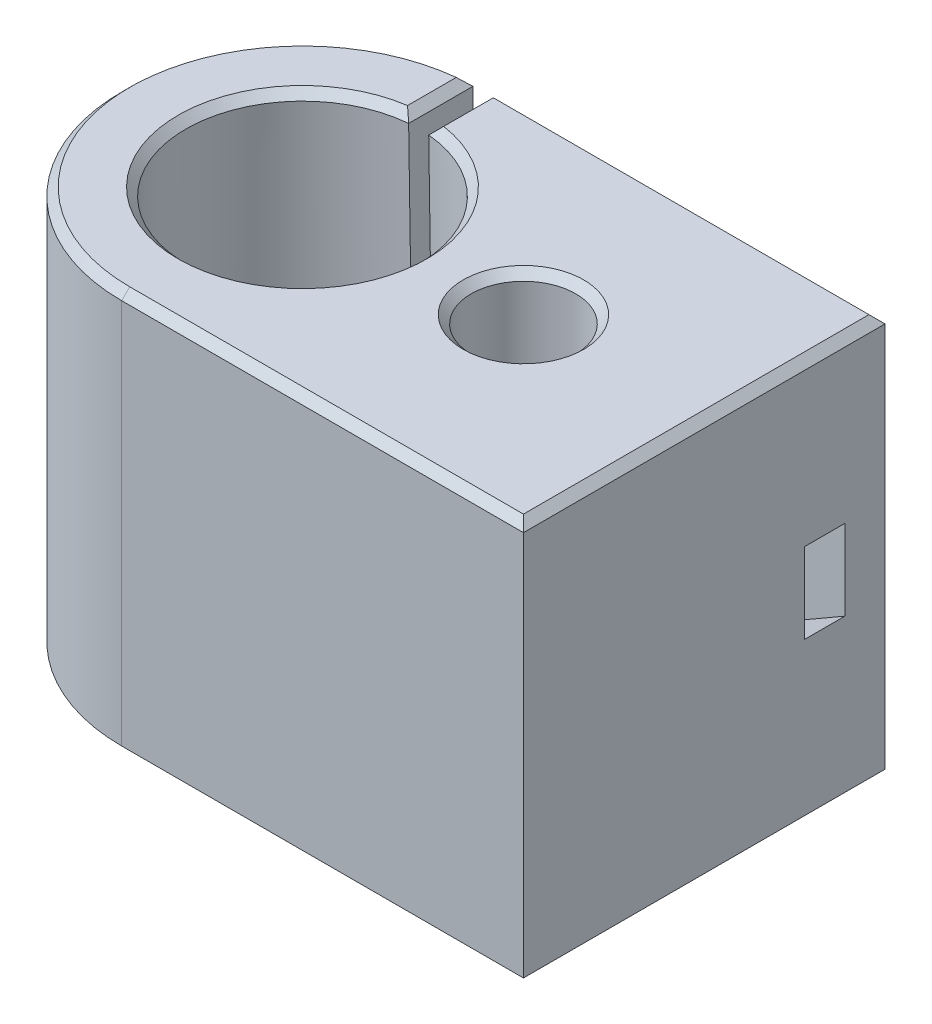
from build123d import *
from OCP.BRepFilletAPI import BRepFilletAPI_MakeChamfer

# Parameters (mm, degrees)
BOSS_EXTRUDE1_DEPTH = 20
SKETCH4_W           = 1
SKETCH4_H           = 9
CUT_EXTRUDE2_DEPTH  = 20
CUT_EXTRUDE4_START  = -2
CUT_EXTRUDE4_DEPTH  = 2
SKETCH5_R           = 2.6
CUT_EXTRUDE5_DEPTH  = 20
CHAMFER1_SIZE       = 0.4
CHAMFER1_SIZE2      = 0.406137053
CHAMFER1_SIZE2_2    = 0.394133002


with BuildPart() as part:
    # Sketch1 → Boss-Extrude1 (new body)
    with BuildSketch(Plane(origin=(0, 0, 0), x_dir=(1, 0, 0), z_dir=(0, 1, 0))):
        with BuildLine():
            Line((0, 9), (20, 9))
            Line((20, 9), (20, -9))
            Line((20, -9), (0, -9))
            ThreePointArc((0, -9), (-9, 0), (0, 9))
        make_face()
    extrude(amount=BOSS_EXTRUDE1_DEPTH)

    # Sketch7 → Cut-Revolve1 (revolve, cut)
    with BuildSketch(Plane.XY, mode=Mode.PRIVATE) as cut_revolve1_sk:
        Polygon((0, 0), (-6.1, 0), (-5.8, 20), (0, 20), align=None)
    revolve(cut_revolve1_sk.sketch.rotate(Axis((0, 20, 0), (0, 1, 0)), 180), axis=Axis((0, 20, 0), (0, 1, 0)), mode=Mode.SUBTRACT)

    # Sketch4 → Cut-Extrude2 (cut)
    with BuildSketch(Plane(origin=(0, 20, 0), x_dir=(1, 0, 0), z_dir=(0, 1, 0))):
        with Locations((0, 4.5)):
            Rectangle(SKETCH4_W, SKETCH4_H)
    extrude(amount=-CUT_EXTRUDE2_DEPTH, mode=Mode.SUBTRACT)

    # Sketch6 → Cut-Extrude4 (cut)
    with BuildSketch(Plane(origin=(0, 0, -9), x_dir=(-1, 0, 0), z_dir=(0, 0, -1)).offset(CUT_EXTRUDE4_START)):
        Polygon((-20, 12), (-14, 15.464101615), (-14, 4.535898385), (-20, 8), align=None)
    extrude(amount=-CUT_EXTRUDE4_DEPTH, mode=Mode.SUBTRACT)

    # Sketch5 → Cut-Extrude5 (cut)
    with BuildSketch(Plane(origin=(0, 20, 0), x_dir=(1, 0, 0), z_dir=(0, 1, 0))):
        with Locations(Location((11, 0, 0), (0, 0, 270))):
            Circle(SKETCH5_R)
    extrude(amount=-CUT_EXTRUDE5_DEPTH, mode=Mode.SUBTRACT)

    # Chamfer1: one chamfer whose edges measure the first distance from different faces: ONE call of the kernel's chamfer builder (chamfer() names one face for all edges)
    chamfer1_edges_1 = [part.edges().sort_by_distance(p)[0] for p in [
        (0, 0, 6.1),
    ]]
    chamfer1_side_1 = [part.faces().sort_by_distance(p)[0] for p in [
        (8.32015875, 0, 0.063305036),
    ]]
    chamfer1_edges_2 = [part.edges().sort_by_distance(p)[0] for p in [
        (0.5, 0, -7.539736831),
        (10.25, 0, -9),
        (20, 0, 0),
        (10, 0, 9),
        (-0.5, 0, -7.53278702),
        (-8.996524423, 0, 0.250096581),
        (11, 0, -2.6),
        (0.5, 20, -7.389204043),
        (10.25, 20, -9),
        (20, 20, 0),
        (10, 20, 9),
        (-8.996524423, 20, 0.250096581),
        (-0.5, 20, -7.382254232),
        (11, 20, -2.6),
    ]]
    chamfer1_edges_3 = [part.edges().sort_by_distance(p)[0] for p in [
        (0, 20, 5.8),
    ]]
    chamfer1_side_3 = [part.faces().sort_by_distance(p)[0] for p in [
        (0, 10, 5.95),
    ]]
    chamfer1 = BRepFilletAPI_MakeChamfer(part.part.solid().wrapped)
    for e in chamfer1_edges_1:
        chamfer1.Add(CHAMFER1_SIZE, CHAMFER1_SIZE2, e.wrapped, chamfer1_side_1[0].wrapped)  # the first distance lies on this face
    for e in chamfer1_edges_2:
        chamfer1.Add(CHAMFER1_SIZE, e.wrapped)
    for e in chamfer1_edges_3:
        chamfer1.Add(CHAMFER1_SIZE, CHAMFER1_SIZE2_2, e.wrapped, chamfer1_side_3[0].wrapped)  # the first distance lies on this face
    add(Compound.cast(chamfer1.Shape()), mode=Mode.REPLACE)


solid = part.part
